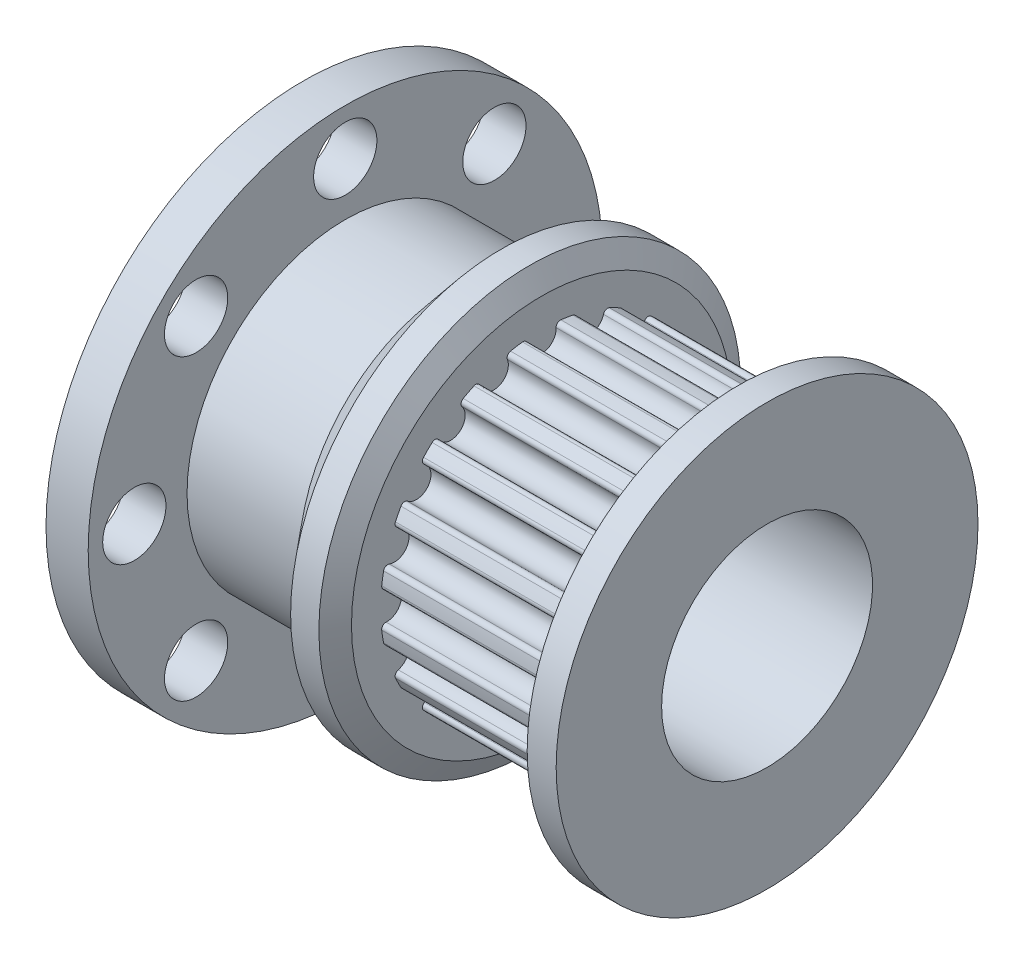
from build123d import *

# Parameters (mm, degrees)
SKETCH_2_R            = 3.175
BORE_DEPTH            = 20.595917942
SKETCH_3_R            = 0.55
CUT_EXTRUDE_20T_DEPTH = 7
FILLET_2_R            = 0.16
SKETCH4_R             = 9.75
BOSS_EXTRUDE3_DEPTH   = 1.6
SKETCH5_R             = 4
CUT_EXTRUDE3_DEPTH    = 23.358108149
CUT_EXTRUDE4_REACH    = 24.358
SKETCH11_R            = 1.2
CIRPATTERN1_COUNT     = 8
BOSS_EXTRUDE4_REACH   = 24.358
SKETCH12_R            = 4.536298995
SKETCH12_R_2          = 4.231357606


with BuildPart() as part:
    # Эскиз1 → Body (revolve)
    with BuildSketch(Plane.XY, mode=Mode.PRIVATE) as body_sk:
        Polygon((0, 6), (0, 0), (16, 0), (16, 4.231357606), (15.847529306, 4.383828301), (16, 4.536298995), (16, 8), (14.900291734, 8), (14.45, 7.213189396), (14.45, 6.11), (7.45, 6.11), (7.45, 7.213189396), (6.999708266, 8), (5.928199262, 8), (4.25, 6), align=None)
    revolve(body_sk.sketch.rotate(Axis((0, 0, 0), (1, 0, 0)), 90), axis=Axis((0, 0, 0), (1, 0, 0)))

    # Эскиз2 → Bore (cut, through all)
    with BuildSketch(Plane(origin=(16, 0, 0), x_dir=(0, 0, -1), z_dir=(1, 0, 0))):
        Circle(SKETCH_2_R)
    extrude(amount=-BORE_DEPTH, mode=Mode.SUBTRACT)

    # Эскиз3 → 20T (cut)
    with BuildSketch(Plane(origin=(7.45, 0, 0), x_dir=(0, 0, -1), z_dir=(1, 0, 0))):
        with Locations((5.582701751, -1.813929757)):
            Circle(SKETCH_3_R)
        with Locations((4.748929757, -3.450299431)):
            Circle(SKETCH_3_R)
        with Locations((3.450299431, -4.748929757)):
            Circle(SKETCH_3_R)
        with Locations((1.813929757, -5.582701751)):
            Circle(SKETCH_3_R)
        with Locations((0, -5.87)):
            Circle(SKETCH_3_R)
        with Locations((5.87, 0)):
            Circle(SKETCH_3_R)
        with Locations((-1.813929757, -5.582701751)):
            Circle(SKETCH_3_R)
        with Locations((-3.450299431, -4.748929757)):
            Circle(SKETCH_3_R)
        with Locations((-4.748929757, -3.450299431)):
            Circle(SKETCH_3_R)
        with Locations((-5.582701751, -1.813929757)):
            Circle(SKETCH_3_R)
        with Locations((-5.87, 0)):
            Circle(SKETCH_3_R)
        with Locations((-5.582701751, 1.813929757)):
            Circle(SKETCH_3_R)
        with Locations((-4.748929757, 3.450299431)):
            Circle(SKETCH_3_R)
        with Locations((-3.450299431, 4.748929757)):
            Circle(SKETCH_3_R)
        with Locations((-1.813929757, 5.582701751)):
            Circle(SKETCH_3_R)
        with Locations((0, 5.87)):
            Circle(SKETCH_3_R)
        with Locations((1.813929757, 5.582701751)):
            Circle(SKETCH_3_R)
        with Locations((3.450299431, 4.748929757)):
            Circle(SKETCH_3_R)
        with Locations((4.748929757, 3.450299431)):
            Circle(SKETCH_3_R)
        with Locations((5.582701751, 1.813929757)):
            Circle(SKETCH_3_R)
    extrude(amount=CUT_EXTRUDE_20T_DEPTH, mode=Mode.SUBTRACT)

    # Fillet 2
    fillet_2_edges = [part.edges().sort_by_distance(p)[0] for p in [
        (10.95, -4.629704566, 3.987221543),
        (10.95, -5.22273042, 3.170991479),
        (10.95, -3.170991479, 5.22273042),
        (10.95, -3.987221543, 4.629704566),
        (10.95, -1.401879653, 5.947002055),
        (10.95, -2.36141564, 5.635229913),
        (10.95, 0.504457922, 6.089139693),
        (10.95, -0.504457922, 6.089139693),
        (10.95, 2.36141564, 5.635229913),
        (10.95, 1.401879653, 5.947002055),
        (10.95, 3.987221543, 4.629704566),
        (10.95, 3.170991479, 5.22273042),
        (10.95, 5.22273042, 3.170991479),
        (10.95, 4.629704566, 3.987221543),
        (10.95, 5.947002055, 1.401879653),
        (10.95, 5.635229913, 2.36141564),
        (10.95, 6.089139693, -0.504457922),
        (10.95, 6.089139693, 0.504457922),
        (10.95, 5.635229913, -2.36141564),
        (10.95, 5.947002055, -1.401879653),
        (10.95, 4.629704566, -3.987221543),
        (10.95, 5.22273042, -3.170991479),
        (10.95, 3.170991479, -5.22273042),
        (10.95, 3.987221543, -4.629704566),
        (10.95, 1.401879653, -5.947002055),
        (10.95, 2.36141564, -5.635229913),
        (10.95, -2.36141564, -5.635229913),
        (10.95, -1.401879653, -5.947002055),
        (10.95, -3.987221543, -4.629704566),
        (10.95, -3.170991479, -5.22273042),
        (10.95, -5.22273042, -3.170991479),
        (10.95, -4.629704566, -3.987221543),
        (10.95, -5.947002055, -1.401879653),
        (10.95, -5.635229913, -2.36141564),
        (10.95, -6.089139693, 0.504457922),
        (10.95, -6.089139693, -0.504457922),
        (10.95, -0.504457922, -6.089139693),
        (10.95, 0.504457922, -6.089139693),
        (10.95, -5.635229913, 2.36141564),
        (10.95, -5.947002055, 1.401879653),
    ]]
    fillet(fillet_2_edges, radius=FILLET_2_R)

    # Sketch4 → Boss-Extrude3 (add)
    with BuildSketch(Plane.ZY):
        Circle(SKETCH4_R)
    extrude(amount=BOSS_EXTRUDE3_DEPTH)

    # Sketch5 → Cut-Extrude3 (cut, through all)
    with BuildSketch(Plane.ZY.offset(1.6)):
        Circle(SKETCH5_R)
    extrude(amount=-CUT_EXTRUDE3_DEPTH, mode=Mode.SUBTRACT)

    # Sketch11 → Cut-Extrude4 (cut, up to next)
    with BuildSketch(Plane.ZY.offset(1.6), mode=Mode.PRIVATE) as cut_extrude4_sk1:
        with Locations((8, 0)):
            Circle(SKETCH11_R)
    cut_extrude4_tool1 = extrude(cut_extrude4_sk1.sketch, amount=-CUT_EXTRUDE4_REACH, mode=Mode.PRIVATE) & part.part
    cut_extrude4 = cut_extrude4_tool1.solids().sort_by_distance((-1.6, 0, 8))[0]
    add(cut_extrude4, mode=Mode.SUBTRACT)

    # CirPattern1: Cut-Extrude4 ×8 about axis
    cirpattern1_axis = Axis((0, 0, 0), (1, 0, 0))
    for i in range(1, CIRPATTERN1_COUNT):
        add(cut_extrude4.rotate(cirpattern1_axis, i * 360 / CIRPATTERN1_COUNT), mode=Mode.SUBTRACT)

    # Sketch12 → Boss-Extrude4 (add, up to next)
    with BuildSketch(Plane(origin=(16, 0, 0), x_dir=(0, 0, -1), z_dir=(1, 0, 0)), mode=Mode.PRIVATE) as boss_extrude4_sk1:
        Circle(SKETCH12_R)
        Circle(SKETCH12_R_2, mode=Mode.SUBTRACT)
    boss_extrude4_tool1 = extrude(boss_extrude4_sk1.sketch, amount=-BOSS_EXTRUDE4_REACH, mode=Mode.PRIVATE) - part.part
    add(boss_extrude4_tool1.solids().sort_by_distance((16, 0, 4.407993))[0])


solid = part.part
